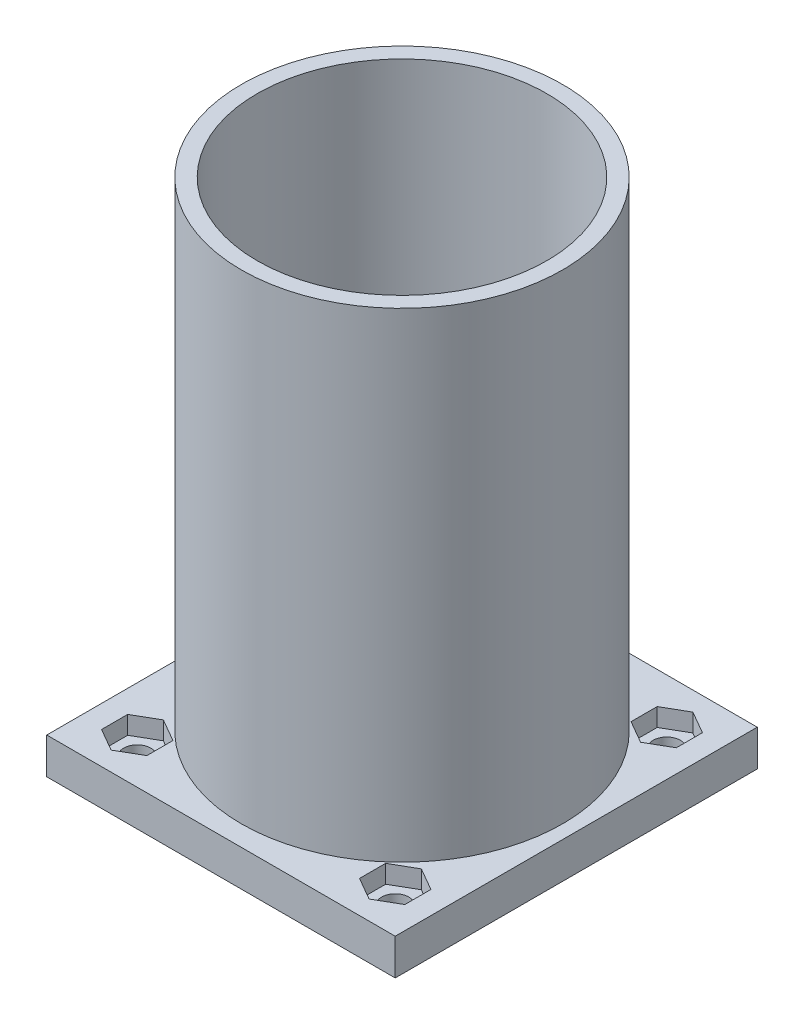
from build123d import *

# Parameters (mm, degrees)
SKETCH1_W           = 77
SKETCH1_H           = 80
SKETCH1_R           = 3
SKETCH1_W_2         = 40
SKETCH1_H_2         = 25
BOSS_EXTRUDE1_DEPTH = 4
CUT_EXTRUDE1_DEPTH  = 10
SKETCH3_R           = 35.5
SKETCH3_R_2         = 32
BOSS_EXTRUDE2_DEPTH = 110
SKETCH5_R           = 32
BOSS_EXTRUDE3_DEPTH = 5


with BuildPart() as part:
    # Sketch1 → Boss-Extrude1 (new, symmetric)
    with BuildSketch(Plane(origin=(0, 0, 0), x_dir=(1, 0, 0), z_dir=(0, 1, 0))):
        Rectangle(SKETCH1_W, SKETCH1_H)
        with Locations(Location((-28.501375206, 30, 0), (0, 0, 270))):
            Circle(SKETCH1_R, mode=Mode.SUBTRACT)
        with Locations(Location((28.5, 30, 0), (0, 0, 270))):
            Circle(SKETCH1_R, mode=Mode.SUBTRACT)
        with Locations(Location((28.5, -30, 0), (0, 0, 90))):
            Circle(SKETCH1_R, mode=Mode.SUBTRACT)
        with Locations(Location((-28.501375206, -30, 0), (0, 0, 90))):
            Circle(SKETCH1_R, mode=Mode.SUBTRACT)
        Rectangle(SKETCH1_W_2, SKETCH1_H_2, mode=Mode.SUBTRACT)
    extrude(amount=BOSS_EXTRUDE1_DEPTH, both=True)

    # Sketch2 → Cut-Extrude1 (cut)
    with BuildSketch(Plane(origin=(0, 0, 0), x_dir=(1, 0, 0), z_dir=(0, 1, 0))):
        Polygon((-33.501375206, -32.886751346), (-33.501375206, -27.113248654), (-28.501375206, -24.226497308), (-23.501375206, -27.113248654), (-23.501375206, -30), (-23.501375206, -32.886751346), (-28.501375206, -35.773502692), align=None)
        Polygon((-23.501375206, 30), (-23.501375206, 27.113248654), (-28.501375206, 24.226497308), (-33.501375206, 27.113248654), (-33.501375206, 32.886751346), (-28.501375206, 35.773502692), (-23.501375206, 32.886751346), align=None)
        Polygon((23.501375206, -30), (23.501375206, -27.113248654), (28.501375206, -24.226497308), (33.501375206, -27.113248654), (33.501375206, -32.886751346), (28.501375206, -35.773502692), (23.501375206, -32.886751346), align=None)
        Polygon((23.501375206, 27.113248654), (28.501375206, 24.226497308), (33.501375206, 27.113248654), (33.501375206, 32.886751346), (28.501375206, 35.773502692), (23.501375206, 32.886751346), (23.501375206, 30), align=None)
    extrude(amount=CUT_EXTRUDE1_DEPTH, mode=Mode.SUBTRACT)

    # Sketch3 → Boss-Extrude2 (add)
    with BuildSketch(Plane(origin=(0, 0, 0), x_dir=(1, 0, 0), z_dir=(0, 1, 0))):
        with Locations(Location((0, 0, 0), (0, 0, 270))):
            Circle(SKETCH3_R)
        with Locations(Location((0, 0, 0), (0, 0, 270))):
            Circle(SKETCH3_R_2, mode=Mode.SUBTRACT)
    extrude(amount=BOSS_EXTRUDE2_DEPTH)

    # Sketch5 → Boss-Extrude3 (add, symmetric)
    with BuildSketch(Plane(origin=(0, 4, 0), x_dir=(1, 0, 0), z_dir=(0, 1, 0))):
        with Locations(Location((0, 0, 0), (0, 0, 270))):
            Circle(SKETCH5_R)
    extrude(amount=BOSS_EXTRUDE3_DEPTH, both=True)


solid = part.part
